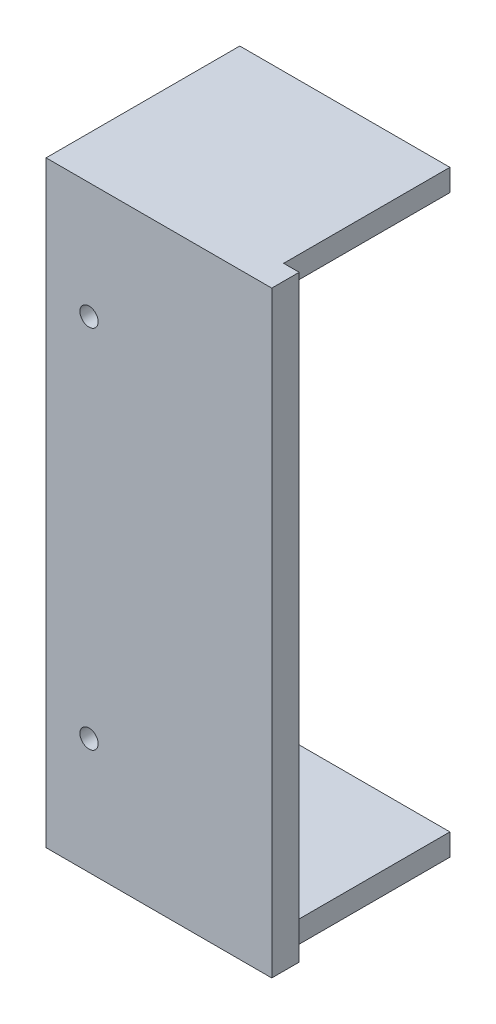
from build123d import *

# Parameters (mm, degrees)
U_SKIRT_DEPTH                 = 18.2
SKETCH2_W                     = 24.7
SKETCH2_H                     = 65.4
TOP_PLATE_DEPTH               = 3
FILAMENT_PIN_HOLES_DEPTH      = 102.826420933
FILAMENT_PIN_HOLES_DEPTH_BACK = 102.826420933
SKETCH3_R                     = 1


with BuildPart() as part:
    # Sketch1 → U_skirt (new body)
    with BuildSketch(Plane.XY.offset(352)):
        Polygon((-94.7, -32.7), (-71.7, -32.7), (-71.7, -30.3), (-92.3, -30.3), (-92.3, 30.3), (-71.7, 30.3), (-71.7, 32.7), (-94.7, 32.7), align=None)
    extrude(amount=U_SKIRT_DEPTH)

    # Sketch2 → Top_plate (add)
    with BuildSketch(Plane.XY.offset(370.2)):
        with Locations((-82.35, 0)):
            Rectangle(SKETCH2_W, SKETCH2_H)
    extrude(amount=TOP_PLATE_DEPTH)

    # Sketch3 → Filament_pin_holes (cut, two sides: drawn at the far end of the back side and taken through both)
    with BuildSketch(Plane.XY.offset(370.2).offset(-FILAMENT_PIN_HOLES_DEPTH_BACK)):
        with Locations((-90, 20)):
            Circle(SKETCH3_R)
        with Locations((-90, -20)):
            Circle(SKETCH3_R)
    extrude(amount=FILAMENT_PIN_HOLES_DEPTH + FILAMENT_PIN_HOLES_DEPTH_BACK, mode=Mode.SUBTRACT)


solid = part.part
